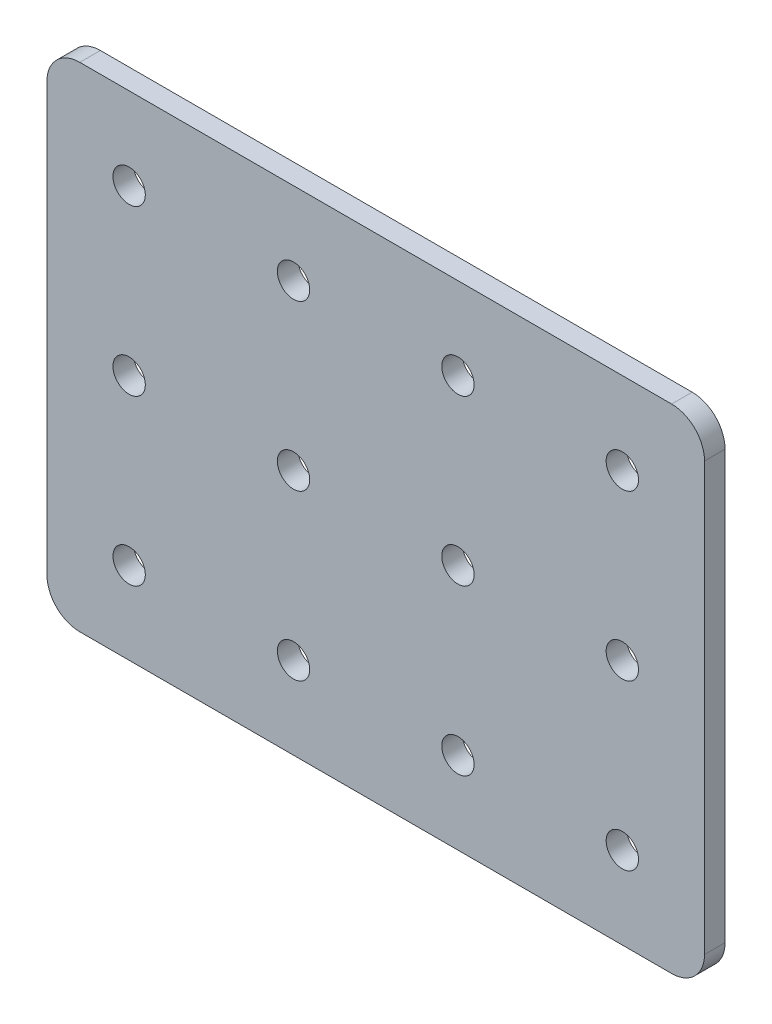
from build123d import *

# Parameters (mm, degrees)
BOSS_EXTRUDE1_START = -3248.025
SKETCH1_R           = 2.5
BOSS_EXTRUDE1_DEPTH = 3.175


with BuildPart() as part:
    # Sketch1 → Boss-Extrude1 (new body)
    with BuildSketch(Plane.XY.offset(BOSS_EXTRUDE1_START)):
        with BuildLine():
            Line((71.12, 76.200000002), (-20.32, 76.200000002))
            ThreePointArc((-20.32, 76.200000002), (-23.912102448, 74.71210245), (-25.4, 71.120000002))
            Line((-25.4, 71.120000002), (-25.4, 5.08))
            ThreePointArc((-25.4, 5.08), (-23.912102448, 1.487897552), (-20.32, 0))
            Line((-20.32, 0), (71.12, 0))
            ThreePointArc((71.12, 0), (74.712102448, 1.487897552), (76.2, 5.08))
            Line((76.2, 5.08), (76.2, 71.120000002))
            ThreePointArc((76.2, 71.120000002), (74.712102448, 74.71210245), (71.12, 76.200000002))
        make_face()
        with Locations(Location((63.5, 63.5, 0), (0, 0, 90))):
            Circle(SKETCH1_R, mode=Mode.SUBTRACT)
        with Locations(Location((63.5, 38.1, 0), (0, 0, 90))):
            Circle(SKETCH1_R, mode=Mode.SUBTRACT)
        with Locations(Location((-12.7, 63.5, 0), (0, 0, 90))):
            Circle(SKETCH1_R, mode=Mode.SUBTRACT)
        with Locations(Location((12.7, 63.5, 0), (0, 0, 90))):
            Circle(SKETCH1_R, mode=Mode.SUBTRACT)
        with Locations(Location((38.1, 63.5, 0), (0, 0, 90))):
            Circle(SKETCH1_R, mode=Mode.SUBTRACT)
        with Locations(Location((-12.7, 38.1, 0), (0, 0, 90))):
            Circle(SKETCH1_R, mode=Mode.SUBTRACT)
        with Locations(Location((12.7, 38.1, 0), (0, 0, 90))):
            Circle(SKETCH1_R, mode=Mode.SUBTRACT)
        with Locations(Location((38.1, 38.1, 0), (0, 0, 90))):
            Circle(SKETCH1_R, mode=Mode.SUBTRACT)
        with Locations(Location((38.1, 12.7, 0), (0, 0, 90))):
            Circle(SKETCH1_R, mode=Mode.SUBTRACT)
        with Locations(Location((12.7, 12.7, 0), (0, 0, 90))):
            Circle(SKETCH1_R, mode=Mode.SUBTRACT)
        with Locations(Location((-12.7, 12.7, 0), (0, 0, 90))):
            Circle(SKETCH1_R, mode=Mode.SUBTRACT)
        with Locations(Location((63.5, 12.7, 0), (0, 0, 90))):
            Circle(SKETCH1_R, mode=Mode.SUBTRACT)
    extrude(amount=-BOSS_EXTRUDE1_DEPTH)


solid = part.part
